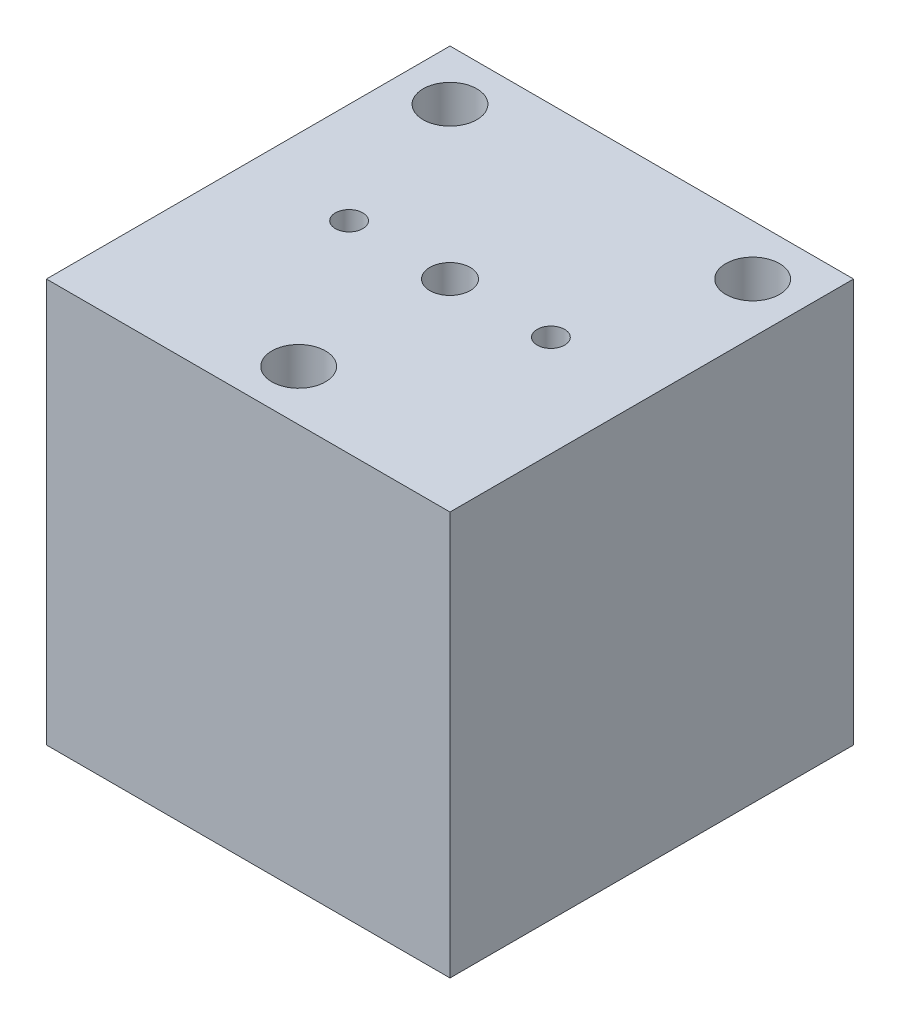
from build123d import *

# Parameters (mm, degrees)
SKETCH1_W                     = 50.8
SKETCH1_H                     = 50.8
BOSS_EXTRUDE1_DEPTH           = 50.8
F_1_4_CLEARANCE_HOLE1_D       = 6.7564
SKETCH4_R                     = 2.54
CUT_EXTRUDE1_DEPTH            = 63.217039467
TAP_DRILL_FOR_8_32_TAP1_D     = 3.4544
TAP_DRILL_FOR_8_32_TAP1_DEPTH = 12.7
TAP_DRILL_FOR_8_32_TAP1_TIP   = 1.037806461


with BuildPart() as part:
    # Sketch1 → Boss-Extrude1 (new body)
    with BuildSketch(Plane(origin=(0, 0, 0), x_dir=(1, 0, 0), z_dir=(0, 1, 0))):
        Rectangle(SKETCH1_W, SKETCH1_H)
    extrude(amount=BOSS_EXTRUDE1_DEPTH)

    # 1/4 Clearance Hole1 (through all)
    with Locations(Plane(origin=(0, 50.8, 0), x_dir=(1, 0, 0), z_dir=(0, 1, 0))):
        with Locations((-19.05, 19.05), (19.05, 19.05), (0, -19.05)):
            Hole(F_1_4_CLEARANCE_HOLE1_D / 2)

    # Sketch4 → Cut-Extrude1 (cut, through all)
    with BuildSketch(Plane(origin=(0, 50.8, 0), x_dir=(1, 0, 0), z_dir=(0, 1, 0))):
        with Locations(Location((0, 0, 0), (0, 0, 270))):
            Circle(SKETCH4_R)
    extrude(amount=-CUT_EXTRUDE1_DEPTH, mode=Mode.SUBTRACT)

    # Tap Drill for #8-32 Tap1
    with Locations(Plane(origin=(0, 50.8, 0), x_dir=(1, 0, 0), z_dir=(0, 1, 0))):
        with Locations((-12.7, 0), (12.7, 0)):
            Hole(TAP_DRILL_FOR_8_32_TAP1_D / 2, depth=TAP_DRILL_FOR_8_32_TAP1_DEPTH)
            with Locations((0, 0, -(TAP_DRILL_FOR_8_32_TAP1_DEPTH + TAP_DRILL_FOR_8_32_TAP1_TIP / 2))):  # 118° drill point
                Cone(0, TAP_DRILL_FOR_8_32_TAP1_D / 2, TAP_DRILL_FOR_8_32_TAP1_TIP, mode=Mode.SUBTRACT)


solid = part.part
